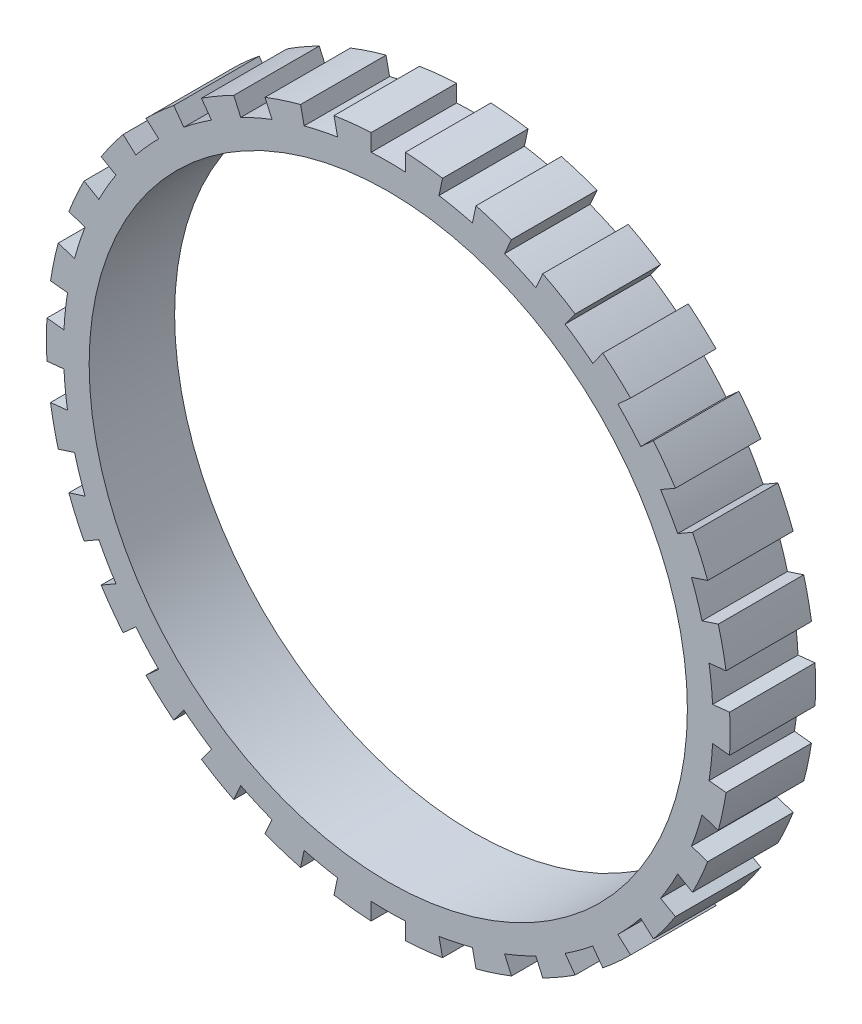
from build123d import *

# Parameters (mm, degrees)
SKETCH1_R           = 40
SKETCH1_R_2         = 35
BOSS_EXTRUDE1_DEPTH = 10
CUT_EXTRUDE5_DEPTH  = 10
CIRPATTERN2_COUNT   = 30


with BuildPart() as part:
    # Sketch1 → Boss-Extrude1 (new body)
    with BuildSketch(Plane.XY):
        Circle(SKETCH1_R)
        Circle(SKETCH1_R_2, mode=Mode.SUBTRACT)
    extrude(amount=BOSS_EXTRUDE1_DEPTH)

    # Sketch4 → Cut-Extrude5 (cut)
    with BuildSketch(Plane.XY):
        with BuildLine():
            Line((2, 37.947331922), (2, 39.949968711))
            ThreePointArc((2, 39.949968711), (0, 40), (-2, 39.949968711))
            Line((-2, 39.949968711), (-2, 37.947331922))
            ThreePointArc((-2, 37.947331922), (0, 38), (2, 37.947331922))
        make_face()
    cut_extrude5 = extrude(amount=CUT_EXTRUDE5_DEPTH, mode=Mode.SUBTRACT)

    # CirPattern2: Cut-Extrude5 ×30 about axis
    cirpattern2_axis = Axis((0, 0, 0), (0, 0, 1))
    for i in range(1, CIRPATTERN2_COUNT):
        add(cut_extrude5.rotate(cirpattern2_axis, i * 360 / CIRPATTERN2_COUNT), mode=Mode.SUBTRACT)


solid = part.part
